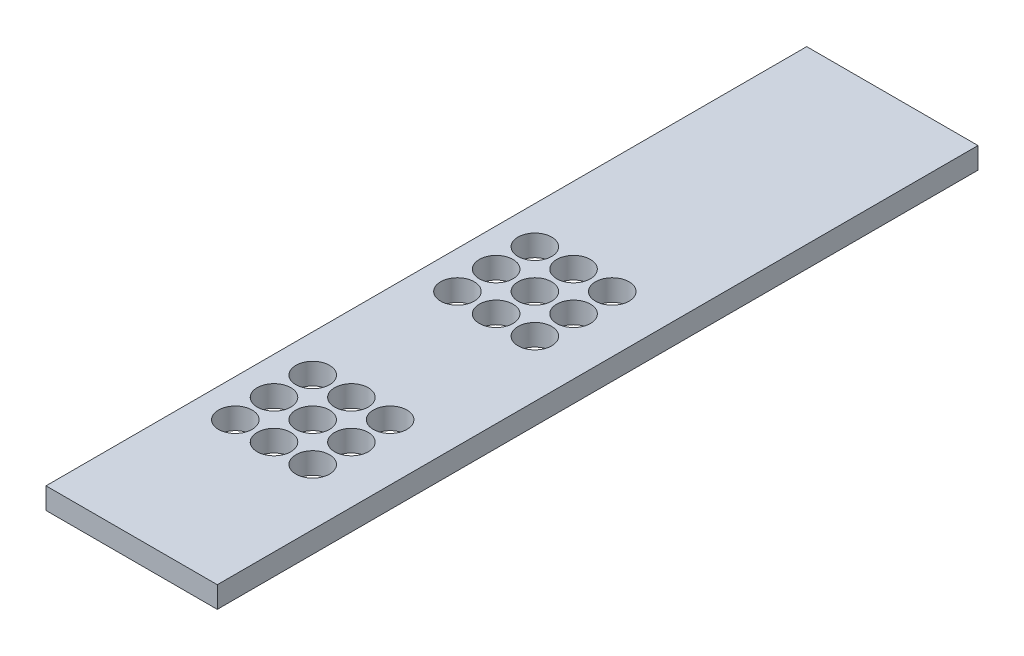
from build123d import *

# Parameters (mm, degrees)
SKETCH1_W                 = 50.8889
SKETCH1_H                 = 6.35
BOSS_EXTRUDE1_DEPTH       = 225.99904
SKETCH3_R                 = 5.000000033
CUT_EXTRUDE1_DEPTH        = 228.515512914
LPATTERN1_COUNT           = 3
LPATTERN1_PITCH           = 11.500000114
LPATTERN1_COUNT_DIR2      = 3
LPATTERN1_PITCH_DIR2      = 11.500000114
LPATTERN2_COUNT           = 2
LPATTERN2_PITCH           = 66.00000008
LPATTERN2_COPY_1_SKETCH_R = 5.000000033
LPATTERN2_COPY_1_DEPTH    = 228.515512914
LPATTERN2_COPY_2_SKETCH_R = 5.000000033
LPATTERN2_COPY_2_DEPTH    = 228.515512914
LPATTERN2_COPY_3_SKETCH_R = 5.000000033
LPATTERN2_COPY_3_DEPTH    = 228.515512914
LPATTERN2_COPY_4_SKETCH_R = 5.000000033
LPATTERN2_COPY_4_DEPTH    = 228.515512914
LPATTERN2_COPY_5_SKETCH_R = 5.000000033
LPATTERN2_COPY_5_DEPTH    = 228.515512914
LPATTERN2_COPY_6_SKETCH_R = 5.000000033
LPATTERN2_COPY_6_DEPTH    = 228.515512914
LPATTERN2_COPY_7_SKETCH_R = 5.000000033
LPATTERN2_COPY_7_DEPTH    = 228.515512914
LPATTERN2_COPY_8_SKETCH_R = 5.000000033
LPATTERN2_COPY_8_DEPTH    = 228.515512914


with BuildPart() as part:
    # Sketch1 → Boss-Extrude1 (new body)
    with BuildSketch(Plane.XY):
        Rectangle(SKETCH1_W, SKETCH1_H)
    extrude(amount=BOSS_EXTRUDE1_DEPTH)

    # Sketch3 → Cut-Extrude1 (cut, through all)
    with BuildSketch(Plane(origin=(0, 3.175, 0), x_dir=(1, 0, 0), z_dir=(0, 1, 0))):
        with Locations(Location((8.669450022, -180.875882939, 0), (0, 0, 270))):
            Circle(SKETCH3_R)
    cut_extrude1 = extrude(amount=-CUT_EXTRUDE1_DEPTH, mode=Mode.SUBTRACT)

    # LPattern1: Cut-Extrude1 3 × 3
    with Locations(*[(-i * LPATTERN1_PITCH, 0, -j * LPATTERN1_PITCH_DIR2) for i in range(LPATTERN1_COUNT) for j in range(LPATTERN1_COUNT_DIR2) if (i, j) != (0, 0)]):
        add(cut_extrude1, mode=Mode.SUBTRACT)

    # LPattern2: Cut-Extrude1 ×2
    with Locations(*[(0, 0, -i * LPATTERN2_PITCH) for i in range(1, LPATTERN2_COUNT)]):
        add(cut_extrude1, mode=Mode.SUBTRACT)

    # LPattern2 copy 1 sketch → LPattern2 copy 1 (cut, through all)
    with BuildSketch(Plane(origin=(0, 3.175, -77.500000194), x_dir=(1, 0, 0), z_dir=(0, 1, 0))):
        with Locations(Location((8.669450022, -180.875882939, 0), (0, 0, 270))):
            Circle(LPATTERN2_COPY_1_SKETCH_R)
    extrude(amount=-LPATTERN2_COPY_1_DEPTH, mode=Mode.SUBTRACT)

    # LPattern2 copy 2 sketch → LPattern2 copy 2 (cut, through all)
    with BuildSketch(Plane(origin=(0, 3.175, -89.000000308), x_dir=(1, 0, 0), z_dir=(0, 1, 0))):
        with Locations(Location((8.669450022, -180.875882939, 0), (0, 0, 270))):
            Circle(LPATTERN2_COPY_2_SKETCH_R)
    extrude(amount=-LPATTERN2_COPY_2_DEPTH, mode=Mode.SUBTRACT)

    # LPattern2 copy 3 sketch → LPattern2 copy 3 (cut, through all)
    with BuildSketch(Plane(origin=(-11.500000114, 3.175, -66.00000008), x_dir=(1, 0, 0), z_dir=(0, 1, 0))):
        with Locations(Location((8.669450022, -180.875882939, 0), (0, 0, 270))):
            Circle(LPATTERN2_COPY_3_SKETCH_R)
    extrude(amount=-LPATTERN2_COPY_3_DEPTH, mode=Mode.SUBTRACT)

    # LPattern2 copy 4 sketch → LPattern2 copy 4 (cut, through all)
    with BuildSketch(Plane(origin=(-11.500000114, 3.175, -77.500000194), x_dir=(1, 0, 0), z_dir=(0, 1, 0))):
        with Locations(Location((8.669450022, -180.875882939, 0), (0, 0, 270))):
            Circle(LPATTERN2_COPY_4_SKETCH_R)
    extrude(amount=-LPATTERN2_COPY_4_DEPTH, mode=Mode.SUBTRACT)

    # LPattern2 copy 5 sketch → LPattern2 copy 5 (cut, through all)
    with BuildSketch(Plane(origin=(-11.500000114, 3.175, -89.000000308), x_dir=(1, 0, 0), z_dir=(0, 1, 0))):
        with Locations(Location((8.669450022, -180.875882939, 0), (0, 0, 270))):
            Circle(LPATTERN2_COPY_5_SKETCH_R)
    extrude(amount=-LPATTERN2_COPY_5_DEPTH, mode=Mode.SUBTRACT)

    # LPattern2 copy 6 sketch → LPattern2 copy 6 (cut, through all)
    with BuildSketch(Plane(origin=(-23.000000228, 3.175, -66.00000008), x_dir=(1, 0, 0), z_dir=(0, 1, 0))):
        with Locations(Location((8.669450022, -180.875882939, 0), (0, 0, 270))):
            Circle(LPATTERN2_COPY_6_SKETCH_R)
    extrude(amount=-LPATTERN2_COPY_6_DEPTH, mode=Mode.SUBTRACT)

    # LPattern2 copy 7 sketch → LPattern2 copy 7 (cut, through all)
    with BuildSketch(Plane(origin=(-23.000000228, 3.175, -77.500000194), x_dir=(1, 0, 0), z_dir=(0, 1, 0))):
        with Locations(Location((8.669450022, -180.875882939, 0), (0, 0, 270))):
            Circle(LPATTERN2_COPY_7_SKETCH_R)
    extrude(amount=-LPATTERN2_COPY_7_DEPTH, mode=Mode.SUBTRACT)

    # LPattern2 copy 8 sketch → LPattern2 copy 8 (cut, through all)
    with BuildSketch(Plane(origin=(-23.000000228, 3.175, -89.000000308), x_dir=(1, 0, 0), z_dir=(0, 1, 0))):
        with Locations(Location((8.669450022, -180.875882939, 0), (0, 0, 270))):
            Circle(LPATTERN2_COPY_8_SKETCH_R)
    extrude(amount=-LPATTERN2_COPY_8_DEPTH, mode=Mode.SUBTRACT)


solid = part.part
